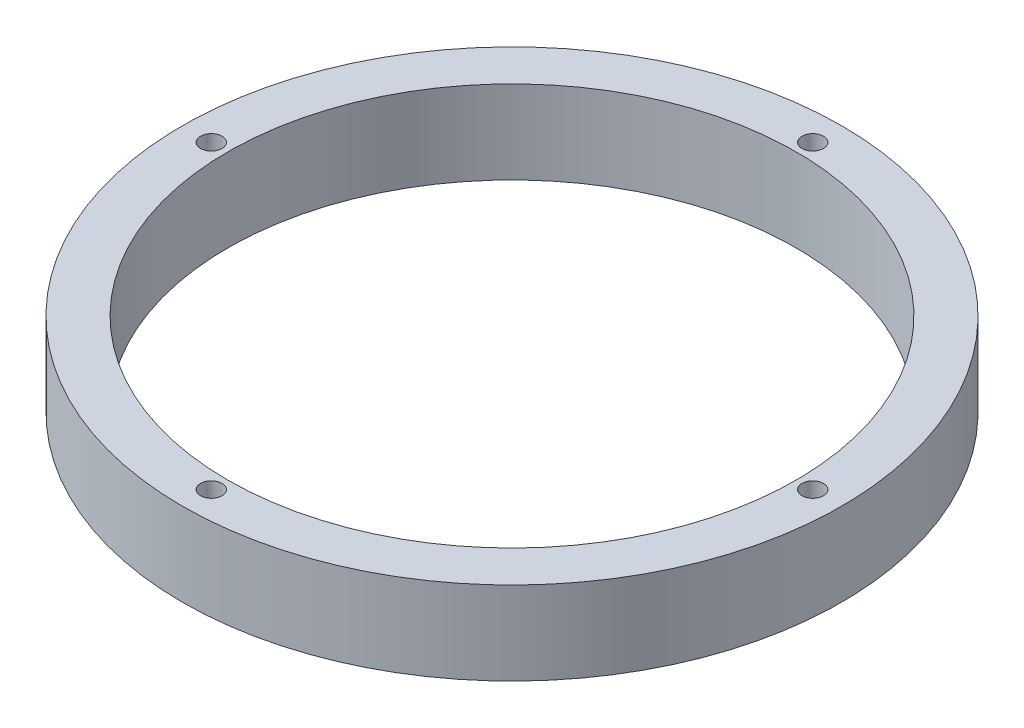
from build123d import *

# Parameters (mm, degrees)
SKETCH1_R           = 80
SKETCH1_R_2         = 2.6
SKETCH1_R_3         = 69
BOSS_EXTRUDE1_DEPTH = 20.2


with BuildPart() as part:
    # Sketch1 → Boss-Extrude1 (new body)
    with BuildSketch(Plane(origin=(0, 0, 0), x_dir=(1, 0, 0), z_dir=(0, 1, 0))):
        with Locations(Location((0, 0, 0), (0, 0, 270))):
            Circle(SKETCH1_R)
        with Locations(Location((0, 73, 0), (0, 0, 270))):
            Circle(SKETCH1_R_2, mode=Mode.SUBTRACT)
        with Locations(Location((73, 0, 0), (0, 0, 270))):
            Circle(SKETCH1_R_2, mode=Mode.SUBTRACT)
        with Locations(Location((0, -73, 0), (0, 0, 270))):
            Circle(SKETCH1_R_2, mode=Mode.SUBTRACT)
        with Locations(Location((-73, 0, 0), (0, 0, 270))):
            Circle(SKETCH1_R_2, mode=Mode.SUBTRACT)
        with Locations(Location((0, 0, 0), (0, 0, 270))):
            Circle(SKETCH1_R_3, mode=Mode.SUBTRACT)
    extrude(amount=BOSS_EXTRUDE1_DEPTH)


solid = part.part
